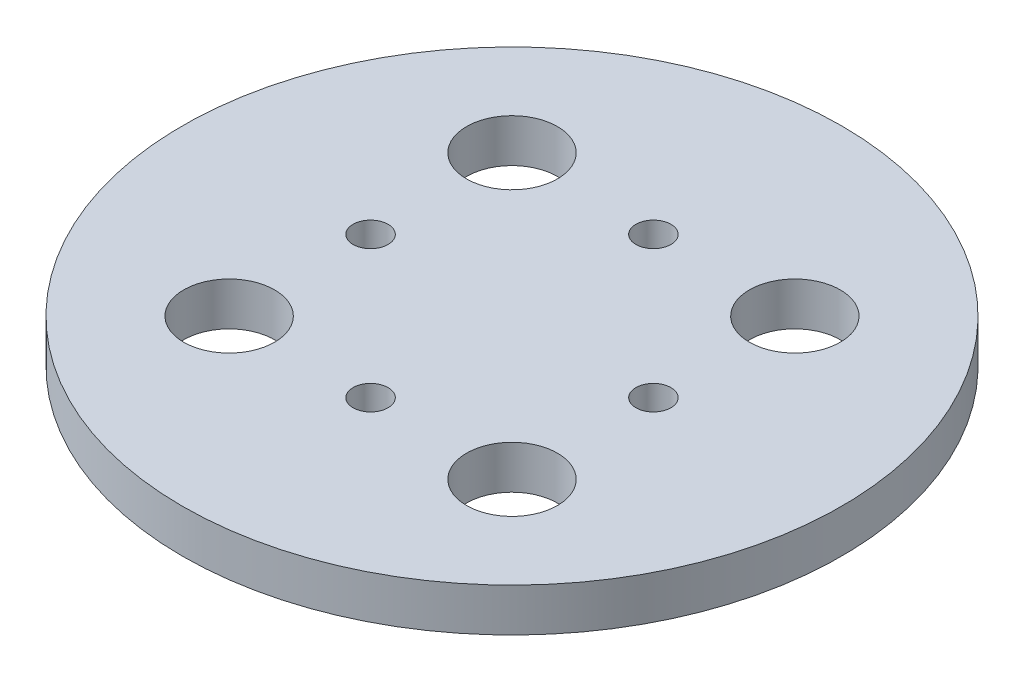
from build123d import *

# Parameters (mm, degrees)
SKETCH2_R           = 76.2
SKETCH2_R_2         = 10.5
SKETCH2_R_3         = 4.05
BOSS_EXTRUDE2_DEPTH = 10


with BuildPart() as part:
    # Sketch2 → Boss-Extrude2 (new body)
    with BuildSketch(Plane(origin=(0, 0, 0), x_dir=(1, 0, 0), z_dir=(0, 1, 0))):
        with Locations(Location((0, 0, 0), (0, 0, 270))):
            Circle(SKETCH2_R)
        with Locations(Location((-32.7, 32.7, 0), (0, 0, 270))):
            Circle(SKETCH2_R_2, mode=Mode.SUBTRACT)
        with Locations(Location((32.7, 32.7, 0), (0, 0, 270))):
            Circle(SKETCH2_R_2, mode=Mode.SUBTRACT)
        with Locations(Location((32.7, -32.7, 0), (0, 0, 270))):
            Circle(SKETCH2_R_2, mode=Mode.SUBTRACT)
        with Locations(Location((-32.7, -32.7, 0), (0, 0, 270))):
            Circle(SKETCH2_R_2, mode=Mode.SUBTRACT)
        with Locations(Location((0, 32.7, 0), (0, 0, 270))):
            Circle(SKETCH2_R_3, mode=Mode.SUBTRACT)
        with Locations(Location((32.7, 0, 0), (0, 0, 270))):
            Circle(SKETCH2_R_3, mode=Mode.SUBTRACT)
        with Locations(Location((0, -32.7, 0), (0, 0, 270))):
            Circle(SKETCH2_R_3, mode=Mode.SUBTRACT)
        with Locations(Location((-32.7, 0, 0), (0, 0, 270))):
            Circle(SKETCH2_R_3, mode=Mode.SUBTRACT)
    extrude(amount=BOSS_EXTRUDE2_DEPTH)


solid = part.part
